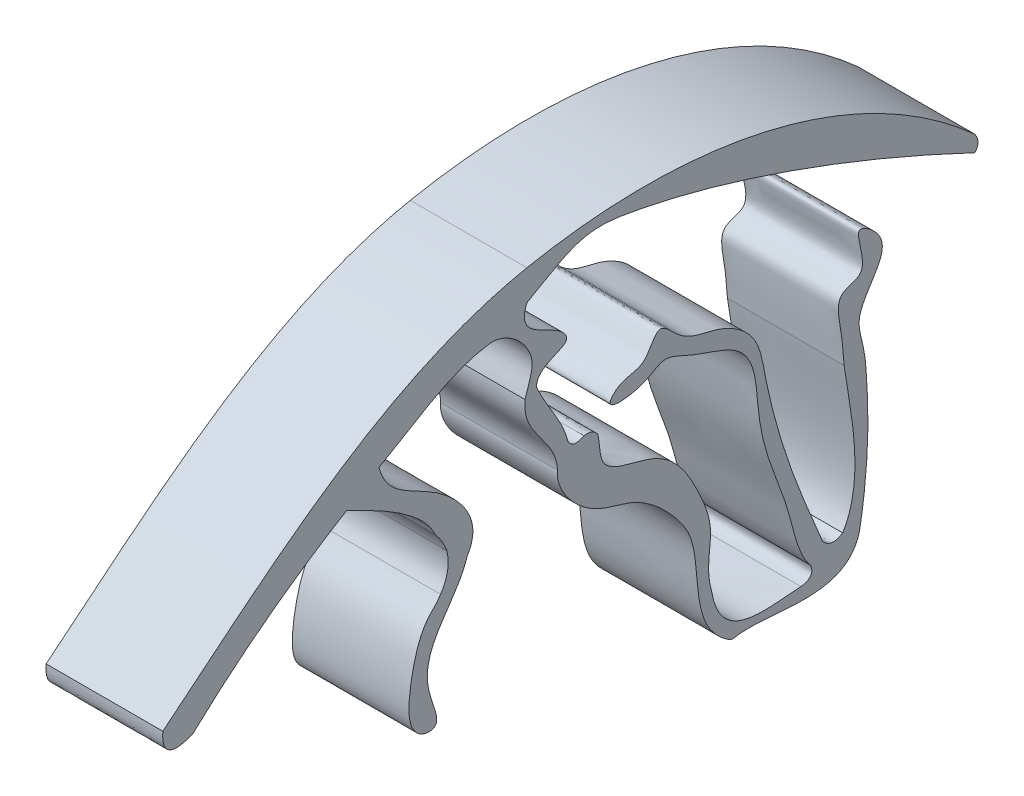
from build123d import *

# Parameters (mm, degrees)
BOSS_EXTRUDE1_DEPTH = 10


with BuildPart() as part:
    # Sketch1 → Boss-Extrude1 (new body)
    with BuildSketch(Plane(origin=(0, 0, 0), x_dir=(0, 0, -1), z_dir=(1, 0, 0))):
        with BuildLine():
            add(Edge.make_bspline(
                [(-10.39771491, 2.720324846), (-10.6553486, 3.506871833), (-11.39550241, 4.425256324)],
                knots=[0.955385123, 0.955385123, 0.955385123, 1, 1, 1], degree=2))
            add(Edge.make_bspline(
                [(-11.39550241, 4.425256324), (-12.63842769, 7.058259393), (-16.782877709, 8.869409421), (-18.972167488, 10.002617311)],
                knots=[0.545737143, 0.545737143, 0.545737143, 0.545737143, 1, 1, 1, 1], degree=3))
            add(Edge.make_bspline(
                [(-32.184437288, 0), (-26.242754622, 5.597848633), (-18.972167488, 10.002617311)],
                knots=[0, 0, 0, 0.556811649, 0.556811649, 0.556811649], degree=2))
            add(Edge.make_bspline(
                [(-34.739009795, 1.489111276), (-34.928724984, -1.08496219), (-32.184437288, 0)],
                knots=[0, 0, 0, 1, 1, 1], degree=2))
            add(Edge.make_bspline(
                [(-34.739009795, 1.489111276), (-25.389417179, 9.098024709), (-15.832751713, 17.839305571), (-3.536012085, 20.288237595)],
                knots=[0, 0, 0, 0, 1, 1, 1, 1], degree=3))
            add(Edge.make_bspline(
                [(-3.536012085, 20.288237595), (10.033802927, 22.961653541), (24.419379057, 20.401040375), (34.851068825, 11.002691644)],
                knots=[0.473951787, 0.473951787, 0.473951787, 0.473951787, 1, 1, 1, 1], degree=3))
            add(Edge.make_bspline(
                [(34.851068825, 11.002691644), (35.386375483, 10.229126729), (34.851068825, 9.627365855)],
                knots=[0, 0, 0, 1, 1, 1], degree=2))
            add(Edge.make_bspline(
                [(34.851068825, 9.627365855), (28.655194332, 12.569641359), (18.811048053, 16.627885106), (7.763545936, 19.59173258), (1.018008589, 20.67127134), (-1.771374038, 18.659105751), (-3.535773438, 17.695000564)],
                knots=[0, 0, 0, 0, 0.479063297, 0.70739725, 0.794305452, 0.928423254, 0.928423254, 0.928423254, 0.928423254], degree=3))
            add(Edge.make_bspline(
                [(-3.535773438, 17.695000564), (-4.529645367, 15.346862551), (-1.145875463, 15.099836406), (0.483184414, 12.718462722), (-2.755184122, 12.358625571), (-2.708550132, 11.002691644)],
                knots=[0, 0, 0, 0, 0.202924405, 0.262155305, 0.366680458, 0.366680458, 0.366680458, 0.366680458], degree=3))
            add(Edge.make_bspline(
                [(0, 5.607076944), (-0.510499577, 7.604704852), (-1.922410174, 9.142802275), (-2.708550132, 11.002691644)],
                knots=[0, 0, 0, 0, 1, 1, 1, 1], degree=3))
            add(Edge.make_bspline(
                [(1.356998428, 5.370055993), (0.563557671, 5.010897248), (0.218015253, 5.209568957), (0, 5.607076944)],
                knots=[0.064158532, 0.064158532, 0.064158532, 0.064158532, 0.43671099, 0.43671099, 0.43671099, 0.43671099], degree=3))
            add(Edge.make_bspline(
                [(2.50940923, 4.943498592), (2.030031314, 5.511227017), (1.356998428, 5.370055993)],
                knots=[0, 0, 0, 1, 1, 1], degree=2))
            add(Edge.make_bspline(
                [(12.282708466, -11.602105568), (11.716990302, -9.685895855), (12.685226202, -7.324534068), (10.958156644, -3.072234886), (8.587135946, 1.251163489), (2.449830365, 1.472366858), (2.731341272, 4.273759907), (2.50940923, 4.943498592)],
                knots=[0, 0, 0, 0, 0.083393647, 0.137741817, 0.243698106, 0.320985704, 0.364890338, 0.364890338, 0.364890338, 0.364890338], degree=3))
            add(Edge.make_bspline(
                [(12.282708466, -11.602105568), (13.056317233, -16.354499909), (17.062690995, -15.242216766), (19.94930479, -15.119898595)],
                knots=[0, 0, 0, 0, 0.609650355, 0.609650355, 0.609650355, 0.609650355], degree=3))
            add(Edge.make_bspline(
                [(20.771311412, -13.944151681), (21.196197032, -14.942883665), (19.94930479, -15.119898595)],
                knots=[0, 0, 0, 1, 1, 1], degree=2))
            add(Edge.make_bspline(
                [(21.803515053, -12.701236846), (21.510424659, -11.979324037), (20.086979085, -8.609950032), (18.548891304, -4.636602207), (16.998993569, 0.889518799), (16.328077147, 5.566541982), (13.062924367, 7.8416029), (9.885102551, 7.944829381), (7.677312717, 10.906141675), (6.662605482, 7.687100186), (4.676883881, 8.083433161), (2.784004562, 6.060867849), (6.52825957, 6.414851665), (8.263222162, 8.00060639), (10.541070791, 6.551204394), (16.1298206, 5.201755859), (16.050202751, -0.088853464), (17.080318262, -4.372966621), (19.002010111, -8.82348124), (19.751837022, -12.845238022), (20.771311412, -13.944151681)],
                knots=[0.043284236, 0.043284236, 0.043284236, 0.043284236, 0.070187917, 0.157911966, 0.259538077, 0.309961506, 0.369972377, 0.42125757, 0.450240621, 0.480238183, 0.514104211, 0.52894326, 0.5704914, 0.596433072, 0.632481793, 0.677832483, 0.763885266, 0.843044692, 0.900044622, 0.955273514, 0.955273514, 0.955273514, 0.955273514], degree=3))
            add(Edge.make_bspline(
                [(23.523290907, -12.920477779), (22.585123871, -13.55230509), (21.803515053, -12.701236846)],
                knots=[0, 0, 0, 1, 1, 1], degree=2))
            add(Edge.make_bspline(
                [(23.649364418, -0.570525066), (24.038851296, -3.662404668), (25.59817464, -9.640031528), (23.523290907, -12.920477779)],
                knots=[0, 0, 0, 0, 0.825093396, 0.825093396, 0.825093396, 0.825093396], degree=3))
            add(Edge.make_bspline(
                [(25.539093083, -2.001333882), (25.526627177, -1.571867968), (25.313121334, 0.473862866), (24.508395318, 2.095714393), (26.134367038, 4.674000364), (27.742397109, 7.169970905), (23.781144363, 10.051173631), (26.225512577, 5.23872232), (22.769812951, 5.130369279), (23.475539458, 2.008125517), (23.57347437, 0.405107856), (23.649364418, -0.570525066)],
                knots=[0.103532678, 0.103532678, 0.103532678, 0.103532678, 0.137224645, 0.252241445, 0.335792351, 0.453099394, 0.531648935, 0.649934222, 0.712249546, 0.803022393, 0.912855442, 0.912855442, 0.912855442, 0.912855442], degree=3))
            add(Edge.make_bspline(
                [(25.539093083, -2.001333882), (25.851893908, -5.860677805), (25.66324164, -9.683366178), (24.973136277, -13.469399001)],
                knots=[0.101180343, 0.101180343, 0.101180343, 0.101180343, 1, 1, 1, 1], degree=3))
            add(Edge.make_bspline(
                [(14.130814382, -16.077566847), (17.00971518, -15.406986529), (23.863120783, -17.973844454), (24.973136277, -13.469399001)],
                knots=[0, 0, 0, 0, 1, 1, 1, 1], degree=3))
            add(Edge.make_bspline(
                [(-0.92226419, 3.943376594), (-0.988951357, 3.466008935), (-0.4798402, 1.57243922), (2.268596076, -0.96086022), (6.195911145, -1.436403565), (10.150990153, -5.397471193), (11.018465658, -7.938917569), (11.180951229, -14.119753728), (13.741997636, -16.056247168), (14.130814382, -16.077566847)],
                knots=[0.440867396, 0.440867396, 0.440867396, 0.440867396, 0.467019237, 0.535882153, 0.597257596, 0.688483693, 0.789269143, 0.864221741, 0.91256564, 0.91256564, 0.91256564, 0.91256564], degree=3))
            add(Edge.make_bspline(
                [(-0.92226419, 3.943376594), (-0.996988295, 6.55010994), (-4.012529952, 7.766485057), (-3.698718287, 10.582881811)],
                knots=[0, 0, 0, 0, 1, 1, 1, 1], degree=3))
            add(Edge.make_bspline(
                [(-3.698718287, 10.582881811), (-3.388671505, 11.677757377), (-2.257626148, 13.652798056), (-5.284923516, 16.574020194), (-6.938863358, 16.218070209)],
                knots=[0.684063311, 0.684063311, 0.684063311, 0.684063311, 0.804597566, 1, 1, 1, 1], degree=3))
            add(Edge.make_bspline(
                [(-16.218391409, 11.806193211), (-12.977563245, 13.606854446), (-10.331631009, 15.679135304), (-6.938863358, 16.218070209)],
                knots=[0.635290826, 0.635290826, 0.635290826, 0.635290826, 1, 1, 1, 1], degree=3))
            add(Edge.make_bspline(
                [(-16.218391409, 11.806193211), (-15.555317991, 9.228663677), (-11.488640598, 8.509598456), (-7.495401086, 4.029593828), (-8.455964772, 1.755663962), (-8.630107718, 1.489111276)],
                knots=[0, 0, 0, 0, 0.374967464, 0.716088331, 0.771728532, 0.771728532, 0.771728532, 0.771728532], degree=3))
            add(Edge.make_bspline(
                [(-8.630107718, 1.489111276), (-9.570536539, -1.527078585), (-13.642140839, -3.912228848), (-10.746445661, -9.864109982), (-12.558918483, -10.116697337), (-13.887746644, -8.678022289), (-13.445706454, -4.779482618), (-12.53632714, -1.764616784), (-11.239397579, -0.735598583), (-10.939711438, -0.246964835)],
                knots=[0, 0, 0, 0, 0.334755607, 0.434437649, 0.507607284, 0.625275321, 0.74821706, 0.885473894, 0.947564925, 0.947564925, 0.947564925, 0.947564925], degree=3))
            add(Edge.make_bspline(
                [(-10.39771491, 2.720324846), (-10.015843658, 1.115294553), (-10.939711438, -0.246964835)],
                knots=[0, 0, 0, 1, 1, 1], degree=2))
        make_face()
    extrude(amount=BOSS_EXTRUDE1_DEPTH)


solid = part.part
